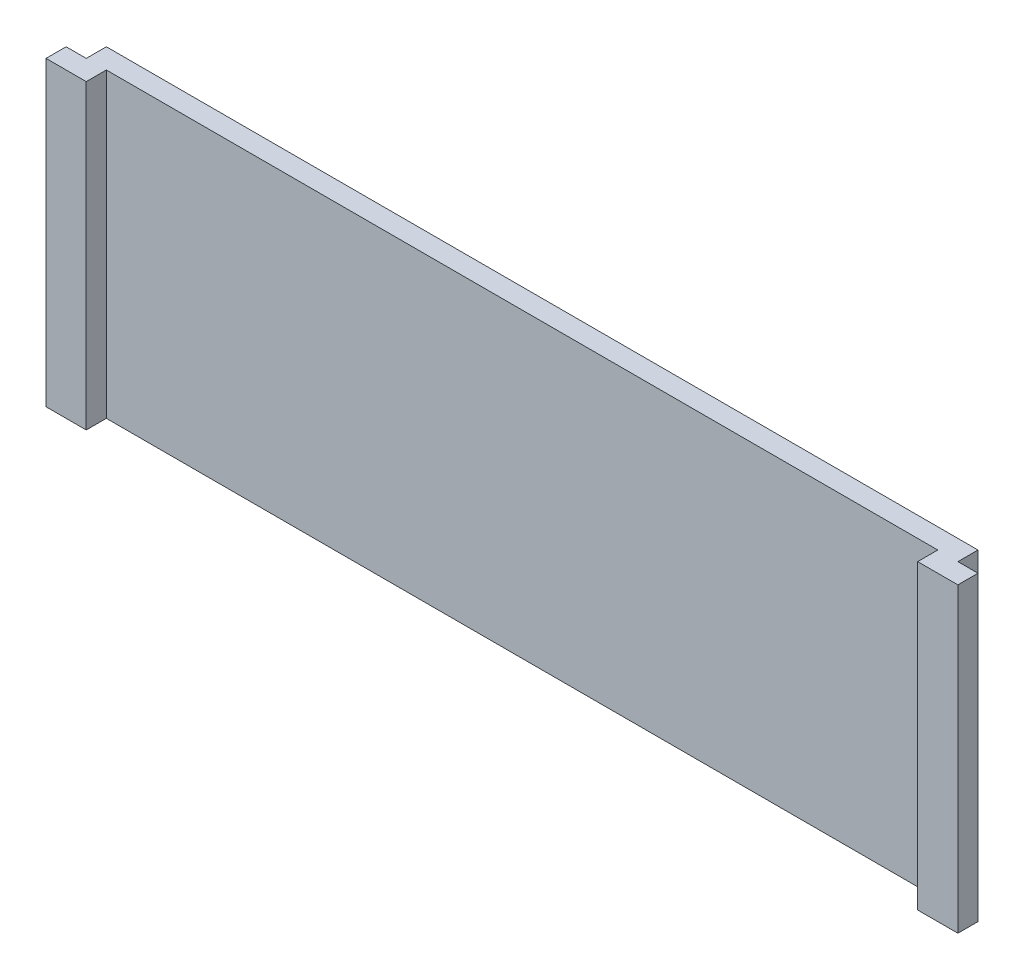
from build123d import *

# Parameters (mm, degrees)
SKETCH_1_W      = 130
SKETCH_1_H      = 45
EXTRUDE_1_DEPTH = 3
SKETCH_2_W      = 3
SKETCH_2_H      = 45
EXTRUDE_2_DEPTH = 3


with BuildPart() as part:
    # 草圖1 → 填料-伸長1 (new body)
    with BuildSketch(Plane.XY):
        with Locations((51.235306675, 11.234939759)):
            Rectangle(SKETCH_1_W, SKETCH_1_H)
    extrude(amount=EXTRUDE_1_DEPTH)

    # 草圖2 → 填料-伸長2 (add)
    with BuildSketch(Plane.XY.offset(3)):
        with Locations((-15.264693325, 11.234939759)):
            Rectangle(SKETCH_2_W, SKETCH_2_H)
        with Locations((-12.264693325, 11.234939759)):
            Rectangle(SKETCH_2_W, SKETCH_2_H)
        with Locations((117.735306675, 11.234939759)):
            Rectangle(SKETCH_2_W, SKETCH_2_H)
        with Locations((114.735306675, 11.234939759)):
            Rectangle(SKETCH_2_W, SKETCH_2_H)
    extrude(amount=EXTRUDE_2_DEPTH)


solid = part.part
